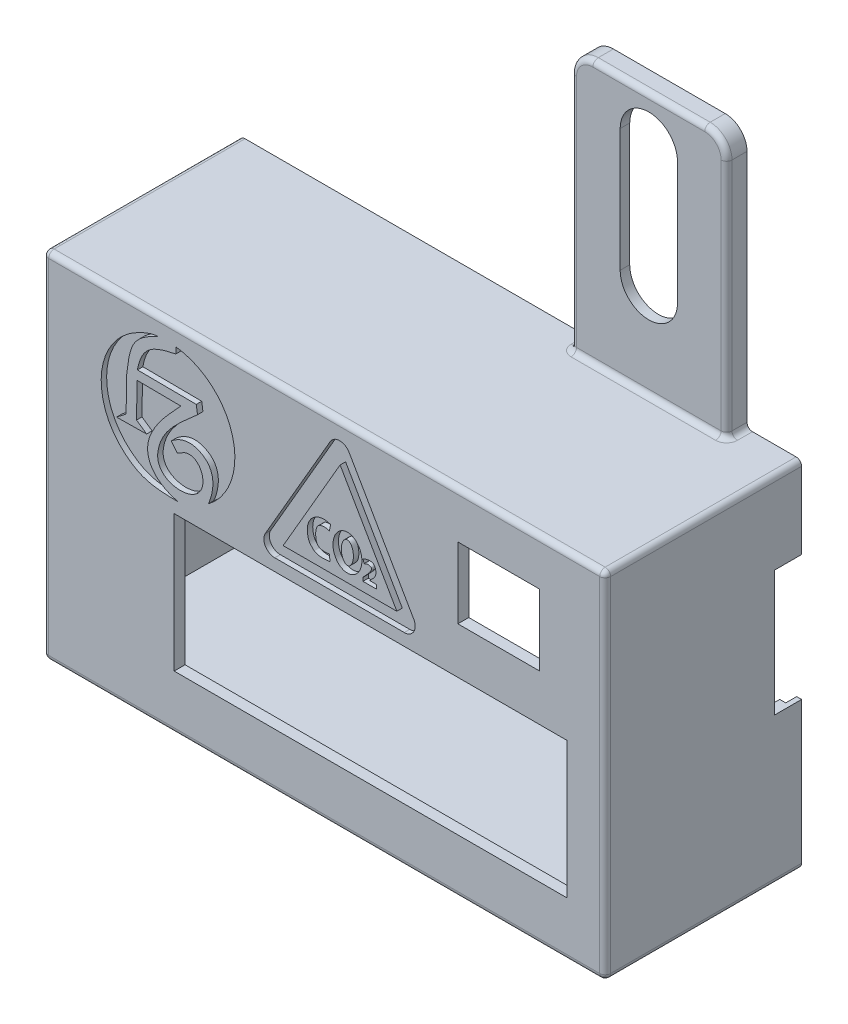
from build123d import *

# Parameters (mm, degrees)
CROQUIS1_W              = 103
CROQUIS1_H              = 65
SALIENTE_EXTRUIR2_DEPTH = 36
VACIADO7_T              = -2
CORTAR_EXTRUIR28_REACH  = 73.683
CROQUIS12_W             = 72
CROQUIS12_H             = 25
SALIENTE_EXTRUIR3_DEPTH = 3.75
CORTAR_EXTRUIR11_DEPTH  = 2
CORTAR_EXTRUIR17_REACH  = 136.414
CROQUIS16_W             = 10
CROQUIS16_H             = 12
CORTAR_EXTRUIR18_DEPTH  = 1
CORTAR_EXTRUIR29_REACH  = 102.551
CROQUIS30_W             = 15
CROQUIS30_H             = 13
CROQUIS20_RX            = 3.244161213
CROQUIS20_RY            = 2.649478984
CROQUIS20_RX_2          = 2.029667585
CROQUIS20_RY_2          = 1.104878059
CORTAR_EXTRUIR24_DEPTH  = 1
CORTAR_EXTRUIR30_REACH  = 136.414
CROQUIS31_W             = 5
CROQUIS31_H             = 23
REDONDEO1_R             = 1


with BuildPart() as part:
    # Croquis1 → Saliente-Extruir2 (new body)
    with BuildSketch(Plane.XY):
        with Locations((0, -2)):
            Rectangle(CROQUIS1_W, CROQUIS1_H)
    extrude(amount=SALIENTE_EXTRUIR2_DEPTH)

    # Vaciado7
    vaciado7_openings = [part.faces().sort_by_distance(p)[0] for p in [
        (0, -2, 0),
    ]]
    offset(amount=VACIADO7_T, openings=vaciado7_openings, kind=Kind.INTERSECTION)

    # Croquis12 → Cortar-Extruir28 (cut, up to next)
    with BuildSketch(Plane.XY.offset(36), mode=Mode.PRIVATE) as cortar_extruir28_sk1:
        with Locations((8.5, -12)):
            Rectangle(CROQUIS12_W, CROQUIS12_H)
    cortar_extruir28_tool1 = extrude(cortar_extruir28_sk1.sketch, amount=-CORTAR_EXTRUIR28_REACH, mode=Mode.PRIVATE) & part.part
    add(cortar_extruir28_tool1.solids().sort_by_distance((8.5, -12, 36))[0], mode=Mode.SUBTRACT)

    # Croquis29 → Saliente-Extruir3 (add)
    with BuildSketch(Plane(origin=(0, 0, 0), x_dir=(-1, 0, 0), z_dir=(0, 0, -1))):
        with BuildLine():
            Line((-13, 74.5), (-13, 30.5))
            Line((-13, 30.5), (-41.5, 30.5))
            Line((-41.5, 30.5), (-41.5, 74.5))
            ThreePointArc((-41.5, 74.5), (-40.328427125, 77.328427125), (-37.5, 78.5))
            Line((-37.5, 78.5), (-17, 78.5))
            ThreePointArc((-17, 78.5), (-14.171572875, 77.328427125), (-13, 74.5))
        make_face()
        with BuildLine():
            Line((-22, 70.25), (-22, 47.75))
            ThreePointArc((-22, 47.75), (-27.25, 42.5), (-32.5, 47.75))
            Line((-32.5, 47.75), (-32.5, 70.25))
            ThreePointArc((-32.5, 70.25), (-27.25, 75.5), (-22, 70.25))
        make_face(mode=Mode.SUBTRACT)
    extrude(amount=-SALIENTE_EXTRUIR3_DEPTH)

    # Croquis14 → Cortar-Extruir11 (cut)
    with BuildSketch(Plane(origin=(0, 0, 0), x_dir=(-1, 0, 0), z_dir=(0, 0, -1))):
        with BuildLine():
            Line((50.6, -33.6), (50.6, 29.6))
            Line((50.6, 29.6), (-13.9, 29.6))
            Line((-13.9, 29.6), (-13.9, 74.5))
            ThreePointArc((-13.9, 74.5), (-14.807968978, 76.692031022), (-17, 77.6))
            Line((-17, 77.6), (-37.5, 77.6))
            ThreePointArc((-37.5, 77.6), (-39.692031022, 76.692031022), (-40.6, 74.5))
            Line((-40.6, 74.5), (-40.6, 29.6))
            Line((-40.6, 29.6), (-50.6, 29.6))
            Line((-50.6, 29.6), (-50.6, -33.6))
            Line((-50.6, -33.6), (50.6, -33.6))
        make_face()
    extrude(amount=-CORTAR_EXTRUIR11_DEPTH, mode=Mode.SUBTRACT)

    # Croquis16 → Cortar-Extruir17 (cut, up to next)
    with BuildSketch(Plane.ZY.offset(51.5), mode=Mode.PRIVATE) as cortar_extruir17_sk1:
        with Locations((7, -10.75)):
            Rectangle(CROQUIS16_W, CROQUIS16_H)
    cortar_extruir17_tool1 = extrude(cortar_extruir17_sk1.sketch, amount=-CORTAR_EXTRUIR17_REACH, mode=Mode.PRIVATE) & part.part
    add(cortar_extruir17_tool1.solids().sort_by_distance((-51.5, -10.75, 7))[0], mode=Mode.SUBTRACT)

    # Croquis19 → Cortar-Extruir18 (cut)
    with BuildSketch(Plane.XY.offset(36)):
        with BuildLine():
            Line((-36.223726294, 18.103236492), (-36.300226294, 11.906736492))
            Line((-36.300226294, 11.906736492), (-38.059726294, 10.529736492))
            Line((-38.059726294, 10.529736492), (-32.551726294, 10.606236492))
            Line((-32.551726294, 10.606236492), (-34.387726294, 11.906736492))
            Line((-34.387726294, 11.906736492), (-34.311226294, 18.256236492))
            Line((-34.311226294, 18.256236492), (-26.278726294, 18.179736492))
            add(Edge.make_bspline(
                [(-26.278726294, 18.179736492), (-28.22370602, 16.018647908), (-30.377985435, 13.917018874), (-31.633726294, 11.294736492), (-33.731422223, 6.914253816), (-31.066306732, 3.789756601), (-26.814226294, 2.726736492)],
                knots=[0, 0, 0, 0, 1, 1, 1, 2, 2, 2, 2], degree=3))
            add(Edge.make_bspline(
                [(-26.814226294, 2.726736492), (-31.033650763, 2.806348274), (-33.722154738, 2.898445732), (-36.988726294, 5.939736492), (-38.346051193, 7.203452776), (-39.499597648, 8.930976283), (-40.125226294, 10.682736492), (-41.971685665, 15.852822731), (-40.336445335, 21.413092312), (-35.994226294, 24.758736492), (-34.777408856, 25.696284354), (-32.043353447, 27.130236492), (-30.486226294, 27.130236492)],
                knots=[0, 0, 0, 0, 1, 1, 1, 2, 2, 2, 3, 3, 3, 4, 4, 4, 4], degree=3))
            add(Edge.make_bspline(
                [(-30.486226294, 27.130236492), (-35.276384078, 24.894829526), (-35.63346627, 23.1794727), (-36.223726294, 18.103236492)],
                knots=[0, 0, 0, 0, 1, 1, 1, 1], degree=3))
        make_face()
        with BuildLine():
            Line((-23.218726294, 18.332736492), (-23.448226294, 19.862736492))
            Line((-23.448226294, 19.862736492), (-34.234726294, 19.939236492))
            add(Edge.make_bspline(
                [(-34.234726294, 19.939236492), (-33.457725428, 24.135041168), (-31.479996794, 25.126082392), (-27.196726294, 25.982736492)],
                knots=[0, 0, 0, 0, 1, 1, 1, 1], degree=3))
            Line((-27.196726294, 25.982736492), (-27.196726294, 27.130236492))
            ThreePointArc((-27.196726294, 27.130236492), (-16.798631859, 18.167602749), (-21.229726294, 5.174736492))
            add(Edge.make_bspline(
                [(-21.229726294, 5.174736492), (-20.082240237, 7.886976262), (-19.647348857, 11.469579934), (-23.142226294, 12.824736492), (-24.964444536, 13.531310912), (-26.67474463, 12.907451746), (-28.038226294, 11.753736492)],
                knots=[0, 0, 0, 0, 1, 1, 1, 2, 2, 2, 2], degree=3))
            Line((-28.038226294, 11.753736492), (-26.890726294, 10.376736492))
            add(Edge.make_bspline(
                [(-26.890726294, 10.376736492), (-26.355226294, 10.657236492), (-25.873262092, 11.082305154), (-25.284226294, 11.218236492), (-22.403339447, 11.883056533), (-20.942132867, 7.258872219), (-23.677726294, 5.480736492), (-26.219571673, 3.828536995), (-31.011904798, 4.940293107), (-30.486226294, 8.770236492), (-29.897675063, 13.058252603), (-26.148390413, 15.628431151), (-23.218726294, 18.332736492)],
                knots=[0, 0, 0, 0, 1, 1, 1, 2, 2, 2, 3, 3, 3, 4, 4, 4, 4], degree=3))
        make_face()
    extrude(amount=-CORTAR_EXTRUIR18_DEPTH, mode=Mode.SUBTRACT)

    # Croquis30 → Cortar-Extruir29 (cut, up to next)
    with BuildSketch(Plane.XY.offset(36), mode=Mode.PRIVATE) as cortar_extruir29_sk1:
        with Locations((32, 15.5)):
            Rectangle(CROQUIS30_W, CROQUIS30_H)
    cortar_extruir29_tool1 = extrude(cortar_extruir29_sk1.sketch, amount=-CORTAR_EXTRUIR29_REACH, mode=Mode.PRIVATE) & part.part
    add(cortar_extruir29_tool1.solids().sort_by_distance((32, 15.5, 36))[0], mode=Mode.SUBTRACT)

    # Croquis20 → Cortar-Extruir24 (cut)
    # profile 1 of 4: a face of its own
    with BuildSketch(Plane.XY.offset(36)):
        with BuildLine():
            Line((4.572618324, 26.236993213), (16.411955601, 5.705897052))
            ThreePointArc((16.411955601, 5.705897052), (16.41117216, 3.706349644), (14.679382618, 2.706802033))
            Line((14.679382618, 2.706802033), (-9.055913318, 2.706802033))
            ThreePointArc((-9.055913318, 2.706802033), (-10.788735979, 3.708140116), (-10.786417318, 5.709476409))
            Line((-10.786417318, 5.709476409), (1.10954134, 26.24057257))
            ThreePointArc((1.10954134, 26.24057257), (2.842112494, 27.237897125), (4.572618324, 26.236993213))
        make_face()
        Polygon((13.315045751, 5.40359616), (-7.525343254, 5.40359616), (2.919708988, 23.430589877), align=None, mode=Mode.SUBTRACT)
    # profile 2 of 4: a face of its own
    with BuildSketch(Plane.XY.offset(36)):
        with BuildLine():
            add(Edge.make_bspline(
                [(0.957947907, 11.978146809), (0.728192104, 12.031167379), (0.503830462, 12.119790003), (0.2686805, 12.137208519), (0.02129854, 12.155533108), (-0.227723762, 12.116972444), (-0.473607477, 12.084187949), (-1.761714803, 11.912440305), (-1.68023315, 9.823064204), (-1.374957163, 9.008994903), (-1.021299456, 8.065907685), (0.210788659, 8.195200955), (0.957947907, 8.319727496)],
                knots=[0, 0, 0, 0, 1, 1, 1, 2, 2, 2, 3, 3, 3, 4, 4, 4, 4], degree=3))
            Line((0.957947907, 8.319727496), (1.063989046, 7.153274962))
            add(Edge.make_bspline(
                [(1.063989046, 7.153274962), (-0.005709113, 7.019562692), (-0.830962431, 6.918514492), (-1.799121721, 7.365357241), (-1.844509042, 7.386305235), (-1.869815814, 7.436051334), (-1.90516286, 7.47139838), (-2.254024165, 7.820259685), (-2.556299158, 8.035105364), (-2.753491976, 8.478789206), (-3.523004311, 10.210191958), (-3.016653464, 12.354905043), (-1.215895453, 13.091578774), (-0.43477741, 13.411127065), (0.394361483, 13.401846255), (1.170030186, 13.091578774)],
                knots=[0, 0, 0, 0, 1, 1, 1, 2, 2, 2, 3, 3, 3, 4, 4, 4, 5, 5, 5, 5], degree=3))
            Line((1.170030186, 13.091578774), (0.957947907, 11.978146809))
        make_face()
    # profile 3 of 4: a face of its own
    with BuildSketch(Plane.XY.offset(36)):
        with Locations(Location((4.261161965, 10.176838891), (0, 0, -90.640192277))):
            Ellipse(CROQUIS20_RX, CROQUIS20_RY)
        with Locations(Location((4.247703103, 10.178918948), (0, 0, -89.299840613))):
            Ellipse(CROQUIS20_RX_2, CROQUIS20_RY_2, mode=Mode.SUBTRACT)
    # profile 4 of 4: a face of its own
    with BuildSketch(Plane.XY.offset(36)):
        with BuildLine():
            add(Edge.make_bspline(
                [(7.108333998, 7.047233822), (7.126007522, 7.276989624), (7.070581952, 7.524698457), (7.161354568, 7.736501229), (7.264651746, 7.977527978), (9.844386297, 10.175447438), (8.009683684, 10.175447438), (7.640359808, 10.175447438), (7.626747901, 10.039948065), (7.320416277, 9.963365159)],
                knots=[0, 0, 0, 0, 1, 1, 1, 2, 2, 2, 3, 3, 3, 3], degree=3))
            Line((7.320416277, 9.963365159), (7.108333998, 10.599611996))
            add(Edge.make_bspline(
                [(7.108333998, 10.599611996), (8.552619624, 11.321754809), (9.674335559, 10.969300864), (9.441239068, 9.221077182), (9.380677119, 8.766862564), (8.584361381, 8.069399194), (8.327807103, 7.789521799)],
                knots=[0, 0, 0, 0, 1, 1, 1, 2, 2, 2, 2], degree=3))
            Line((8.327807103, 7.789521799), (9.601404893, 7.789521799))
            Line((9.601404893, 7.789521799), (9.601404893, 7.04526316))
            Line((9.601404893, 7.04526316), (7.108333998, 7.047233822))
        make_face()
    extrude(amount=-CORTAR_EXTRUIR24_DEPTH, mode=Mode.SUBTRACT)

    # Croquis31 → Cortar-Extruir30 (cut, up to next)
    with BuildSketch(Plane(origin=(51.5, 0, 0), x_dir=(0, 0, -1), z_dir=(1, 0, 0)), mode=Mode.PRIVATE) as cortar_extruir30_sk1:
        with Locations((-2.5, 4)):
            Rectangle(CROQUIS31_W, CROQUIS31_H)
    cortar_extruir30_tool1 = extrude(cortar_extruir30_sk1.sketch, amount=-CORTAR_EXTRUIR30_REACH, mode=Mode.PRIVATE) & part.part
    add(cortar_extruir30_tool1.solids().sort_by_distance((51.5, 4, 2.5))[0], mode=Mode.SUBTRACT)

    # Redondeo1
    redondeo1_edges = [part.edges().sort_by_distance(p)[0] for p in [
        (51.5, -2, 36),
        (0, 30.5, 36),
        (40.328427125, 77.328427125, 3.75),
        (27.25, 78.5, 3.75),
        (14.171572875, 77.328427125, 3.75),
        (13, 52.5, 3.75),
        (27.25, 30.5, 3.75),
        (13, 30.5, 1.875),
        (41.5, 52.5, 3.75),
        (41.5, 30.5, 1.875),
        (-51.5, -2, 36),
        (-51.5, 30.5, 18),
        (51.5, 30.5, 18),
        (51.5, -34.5, 18),
        (-51.5, -34.5, 18),
        (0, -34.5, 36),
    ]]
    fillet(redondeo1_edges, radius=REDONDEO1_R)


solid = part.part
